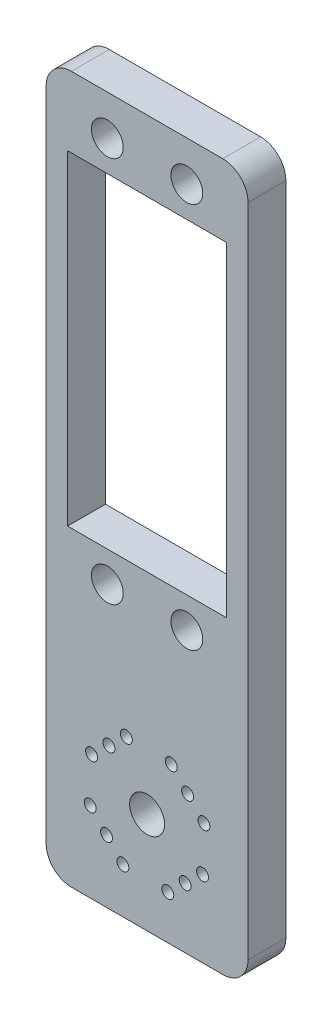
from build123d import *

# Parameters (mm, degrees)
SKETCH1_W           = 25.4
SKETCH1_H           = 88.9
SKETCH1_R           = 2
SKETCH1_R_2         = 10
SKETCH1_W_2         = 20
SKETCH1_H_2         = 40.9
SKETCH1_R_3         = 1.5
SKETCH1_R_4         = 0.75
BOSS_EXTRUDE1_DEPTH = 4.7625
FILLET1_R           = 3.175
SKETCH2_R           = 2.2
CUT_EXTRUDE1_DEPTH  = 93.57997303


with BuildPart() as part:
    # Sketch1 → Boss-Extrude1 (new body)
    # profile 1 of 2: a face of its own
    with BuildSketch(Plane.XY):
        with Locations((12.7, 44.45)):
            Rectangle(SKETCH1_W, SKETCH1_H)
        with Locations(Location((17.7, 35.26, 0), (0, 0, 180))):
            Circle(SKETCH1_R, mode=Mode.SUBTRACT)
        with Locations(Location((7.7, 35.26, 0), (0, 0, 180))):
            Circle(SKETCH1_R, mode=Mode.SUBTRACT)
        with Locations(Location((17.7, 83.86, 0), (0, 0, 180))):
            Circle(SKETCH1_R, mode=Mode.SUBTRACT)
        with Locations(Location((7.7, 83.86, 0), (0, 0, 180))):
            Circle(SKETCH1_R, mode=Mode.SUBTRACT)
        with Locations((12.7, 12.7)):
            Circle(SKETCH1_R_2, mode=Mode.SUBTRACT)
        with Locations((12.7, 59.56)):
            Rectangle(SKETCH1_W_2, SKETCH1_H_2, mode=Mode.SUBTRACT)
    # profile 2 of 2: a face of its own
    with BuildSketch(Plane.XY):
        with Locations((12.7, 12.7)):
            Circle(SKETCH1_R_2)
        with Locations(Location((12.7, 12.7, 0), (0, 0, 180))):
            Circle(SKETCH1_R_3, mode=Mode.SUBTRACT)
        with Locations(Location((10.092137103, 19.855351222, 0), (0, 0, 180))):
            Circle(SKETCH1_R_4, mode=Mode.SUBTRACT)
        with Locations(Location((7.906074869, 17.80081188, 0), (0, 0, 180))):
            Circle(SKETCH1_R_4, mode=Mode.SUBTRACT)
        with Locations(Location((5.720012634, 15.746272538, 0), (0, 0, 180))):
            Circle(SKETCH1_R_4, mode=Mode.SUBTRACT)
        with Locations(Location((5.544648778, 10.092137103, 0), (0, 0, 180))):
            Circle(SKETCH1_R_4, mode=Mode.SUBTRACT)
        with Locations(Location((7.59918812, 7.906074869, 0), (0, 0, 180))):
            Circle(SKETCH1_R_4, mode=Mode.SUBTRACT)
        with Locations(Location((9.653727462, 5.720012634, 0), (0, 0, 180))):
            Circle(SKETCH1_R_4, mode=Mode.SUBTRACT)
        with Locations(Location((15.307862897, 5.544648778, 0), (0, 0, 180))):
            Circle(SKETCH1_R_4, mode=Mode.SUBTRACT)
        with Locations(Location((17.493925131, 7.59918812, 0), (0, 0, 180))):
            Circle(SKETCH1_R_4, mode=Mode.SUBTRACT)
        with Locations(Location((19.679987366, 9.653727462, 0), (0, 0, 180))):
            Circle(SKETCH1_R_4, mode=Mode.SUBTRACT)
        with Locations(Location((19.855351222, 15.307862897, 0), (0, 0, 180))):
            Circle(SKETCH1_R_4, mode=Mode.SUBTRACT)
        with Locations(Location((17.80081188, 17.493925131, 0), (0, 0, 180))):
            Circle(SKETCH1_R_4, mode=Mode.SUBTRACT)
        with Locations(Location((15.746272538, 19.679987366, 0), (0, 0, 180))):
            Circle(SKETCH1_R_4, mode=Mode.SUBTRACT)
    extrude(amount=BOSS_EXTRUDE1_DEPTH)

    # Fillet1
    fillet1_edges = [part.edges().sort_by_distance(p)[0] for p in [
        (0, 0, 2.38125),
        (0, 88.9, 2.38125),
        (25.4, 88.9, 2.38125),
        (25.4, 0, 2.38125),
    ]]
    fillet(fillet1_edges, radius=FILLET1_R)

    # Sketch2 → Cut-Extrude1 (cut, through all)
    with BuildSketch(Plane.XY.offset(4.7625)):
        with Locations((12.7, 12.7)):
            Circle(SKETCH2_R)
    extrude(amount=-CUT_EXTRUDE1_DEPTH, mode=Mode.SUBTRACT)


solid = part.part
